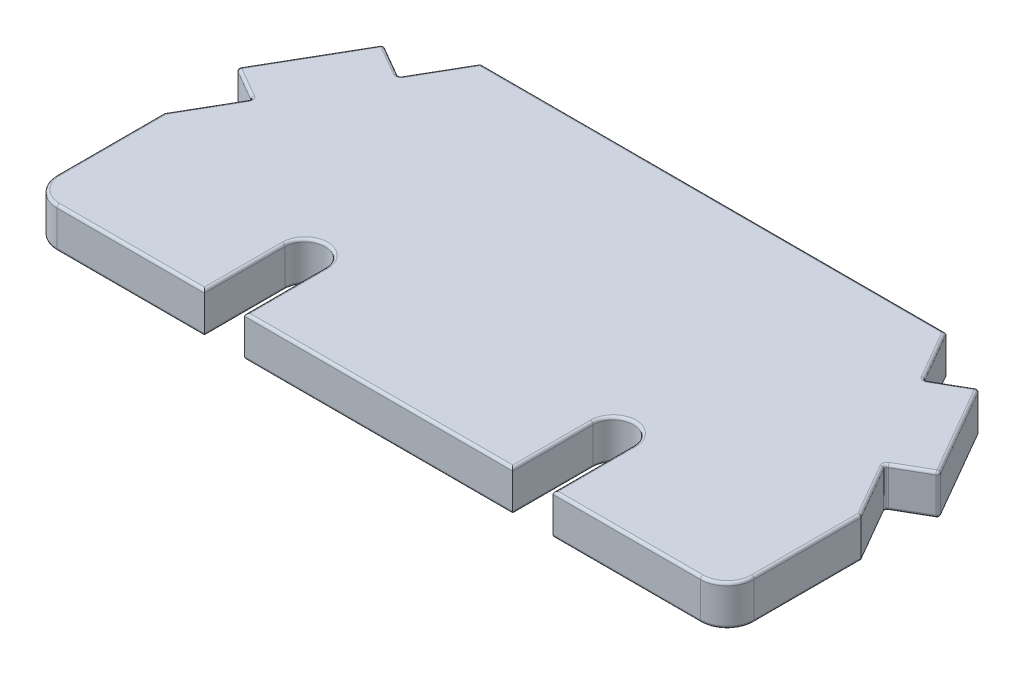
from build123d import *

# Parameters (mm, degrees)
BOSS_EXTRUDE1_DEPTH = 3
FILLET1_R           = 0.2


with BuildPart() as part:
    # Sketch1 → Boss-Extrude1 (new body)
    with BuildSketch(Plane(origin=(0, 0, 0), x_dir=(1, 0, 0), z_dir=(0, 1, 0))):
        with BuildLine():
            Line((10, 0), (-10, 0))
            Line((-10, 0), (-10, 6))
            ThreePointArc((-10, 6), (-11.5, 7.5), (-13, 6))
            Line((-13, 6), (-13, 0))
            Line((-13, 0), (-24, 0))
            ThreePointArc((-24, 0), (-25.414213562, 0.585786438), (-26, 2))
            Line((-26, 2), (-26, 10))
            Line((-26, 10), (-23.607695155, 14.143593539))
            Line((-23.607695155, 14.143593539), (-26.205771366, 15.643593539))
            Line((-26.205771366, 15.643593539), (-22.205771366, 22.57179677))
            Line((-22.205771366, 22.57179677), (-19.607695155, 21.07179677))
            Line((-19.607695155, 21.07179677), (-17.357695155, 24.968911087))
            Line((-17.357695155, 24.968911087), (17.357695155, 24.968911087))
            Line((17.357695155, 24.968911087), (19.607695155, 21.07179677))
            Line((19.607695155, 21.07179677), (22.205771366, 22.57179677))
            Line((22.205771366, 22.57179677), (26.205771366, 15.643593539))
            Line((26.205771366, 15.643593539), (23.607695155, 14.143593539))
            Line((23.607695155, 14.143593539), (26, 10))
            Line((26, 10), (26, 2))
            ThreePointArc((26, 2), (25.414213562, 0.585786438), (24, 0))
            Line((24, 0), (13, 0))
            Line((13, 0), (13, 6))
            ThreePointArc((13, 6), (11.5, 7.5), (10, 6))
            Line((10, 6), (10, 0))
        make_face()
    extrude(amount=BOSS_EXTRUDE1_DEPTH)

    # Fillet1
    fillet1_edges = [part.edges().sort_by_distance(p)[0] for p in [
        (-25.414213562, 3, -0.585786438),
        (-18.5, 3, 0),
        (-13, 3, -3),
        (-11.5, 3, -7.5),
        (-24.90673326, 0, -14.893593539),
        (-24.205771366, 0, -19.107695155),
        (-20.90673326, 0, -21.82179677),
        (-18.482695155, 0, -23.020353928),
        (-10, 3, -3),
        (0, 0, -24.968911087),
        (18.482695155, 0, -23.020353928),
        (20.90673326, 0, -21.82179677),
        (24.205771366, 0, -19.107695155),
        (24.90673326, 0, -14.893593539),
        (24.803847577, 0, -12.07179677),
        (26, 0, -6),
        (25.414213562, 0, -0.585786438),
        (0, 3, 0),
        (18.5, 0, 0),
        (13, 0, -3),
        (11.5, 0, -7.5),
        (10, 0, -3),
        (0, 0, 0),
        (-10, 0, -3),
        (-11.5, 0, -7.5),
        (10, 3, -3),
        (-13, 0, -3),
        (-18.5, 0, 0),
        (-25.414213562, 0, -0.585786438),
        (-26, 0, -6),
        (-24.803847577, 0, -12.07179677),
        (11.5, 3, -7.5),
        (13, 3, -3),
        (18.5, 3, 0),
        (-23.607695155, 1.5, -14.143593539),
        (-26.205771366, 1.5, -15.643593539),
        (-22.205771366, 1.5, -22.57179677),
        (-19.607695155, 1.5, -21.07179677),
        (19.607695155, 1.5, -21.07179677),
        (22.205771366, 1.5, -22.57179677),
        (26.205771366, 1.5, -15.643593539),
        (23.607695155, 1.5, -14.143593539),
        (-24.803847577, 3, -12.07179677),
        (25.414213562, 3, -0.585786438),
        (26, 3, -6),
        (24.803847577, 3, -12.07179677),
        (24.90673326, 3, -14.893593539),
        (24.205771366, 3, -19.107695155),
        (20.90673326, 3, -21.82179677),
        (18.482695155, 3, -23.020353928),
        (0, 3, -24.968911087),
        (-18.482695155, 3, -23.020353928),
        (-20.90673326, 3, -21.82179677),
        (-26, 3, -6),
        (-24.205771366, 3, -19.107695155),
        (-24.90673326, 3, -14.893593539),
    ]]
    fillet(fillet1_edges, radius=FILLET1_R)


solid = part.part
